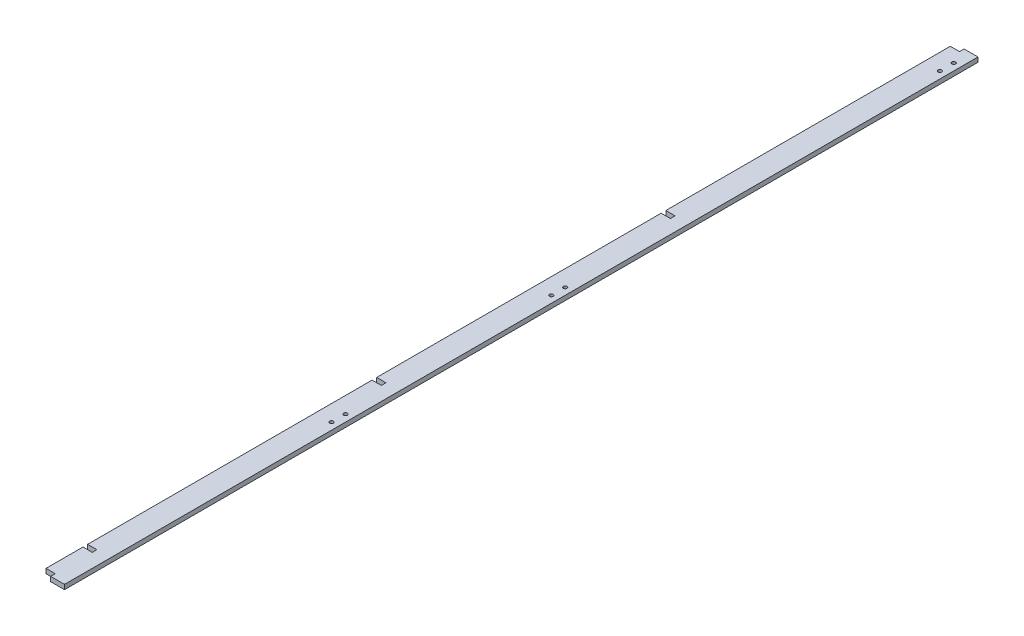
from build123d import *

# Parameters (mm, degrees)
SKETCH_1_W          = 10
SKETCH_1_H          = 2
EXTRUDE_1_DEPTH     = 395
SKETCH_2_R          = 0.8
SKETCH_2_W          = 4
SKETCH_2_H          = 2
CUT_EXTRUDE_1_DEPTH = 1168.361381654


with BuildPart() as part:
    # 草图1 → 凸台-拉伸1 (new body)
    with BuildSketch(Plane.XY.offset(1160.01)):
        with Locations((125.787596038, -4.389694097)):
            Rectangle(SKETCH_1_W, SKETCH_1_H)
    extrude(amount=-EXTRUDE_1_DEPTH)

    # 草图2 → 切除-拉伸1 (cut, through all)
    with BuildSketch(Plane(origin=(0, -3.389694097, 0), x_dir=(1, 0, 0), z_dir=(0, 1, 0))):
        with Locations(Location((127.787596038, -772.51, 0), (0, 0, 180))):
            Circle(SKETCH_2_R)
        with Locations(Location((127.787596038, -778.51, 0), (0, 0, 180))):
            Circle(SKETCH_2_R)
        with Locations(Location((127.787596038, -940.51, 0), (0, 0, 180))):
            Circle(SKETCH_2_R)
        with Locations(Location((127.787596038, -946.51, 0), (0, 0, 180))):
            Circle(SKETCH_2_R)
        with Locations(Location((127.787596038, -1041.51, 0), (0, 0, 180))):
            Circle(SKETCH_2_R)
        with Locations(Location((127.787596038, -1035.51, 0), (0, 0, 180))):
            Circle(SKETCH_2_R)
        with Locations((122.787596038, -891.01)):
            Rectangle(SKETCH_2_W, SKETCH_2_H)
        with Locations((122.787596038, -766.01)):
            Rectangle(SKETCH_2_W, SKETCH_2_H)
        with Locations((122.787596038, -1016.01)):
            Rectangle(SKETCH_2_W, SKETCH_2_H)
        with Locations((122.787596038, -1141.01)):
            Rectangle(SKETCH_2_W, SKETCH_2_H)
        with Locations((122.787596038, -1159.01)):
            Rectangle(SKETCH_2_W, SKETCH_2_H)
    extrude(amount=-CUT_EXTRUDE_1_DEPTH, mode=Mode.SUBTRACT)


solid = part.part
